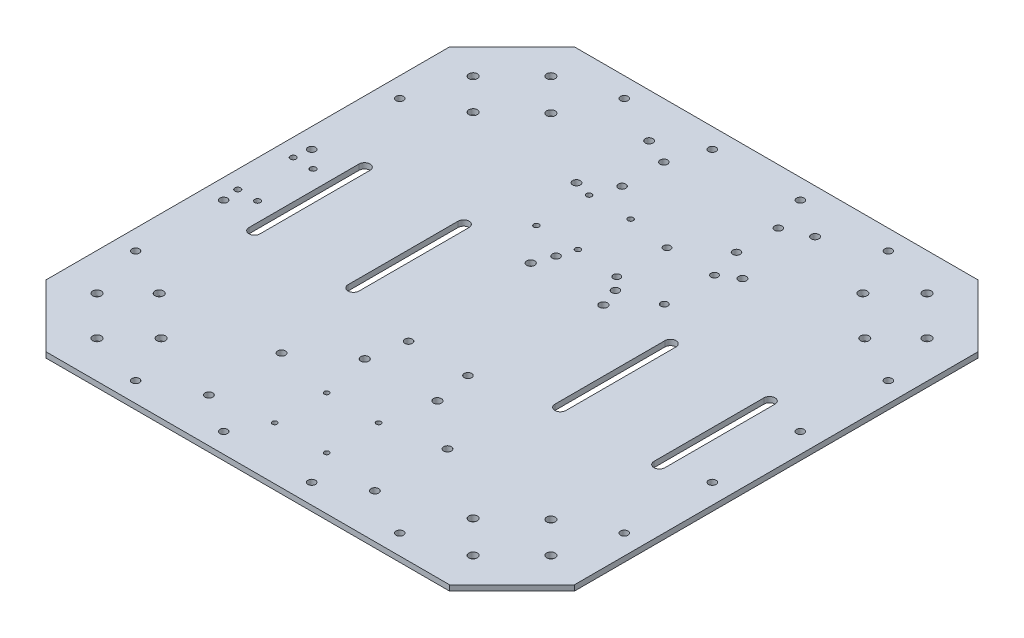
from build123d import *

# Parameters (mm, degrees)
BOSS_EXTRUDE1_DEPTH = 3.175
SKETCH2_R           = 2.4638
CUT_EXTRUDE1_DEPTH  = 6.35
SKETCH3_R           = 2.159
CUT_EXTRUDE2_DEPTH  = 6.35
SKETCH4_R           = 2.2225
SKETCH4_R_2         = 2.286
CUT_EXTRUDE3_DEPTH  = 351.937720963
SKETCH5_R           = 1.651
CUT_EXTRUDE4_DEPTH  = 351.937720963
SKETCH6_R           = 2.032
SKETCH6_R_2         = 2.159
SKETCH6_R_3         = 1.397
SKETCH6_R_4         = 1.5499969
CUT_EXTRUDE5_DEPTH  = 351.937720963
SKETCH7_R           = 2.159
CUT_EXTRUDE6_DEPTH  = 351.937720963
CUT_EXTRUDE8_DEPTH  = 351.937720963


with BuildPart() as part:
    # Sketch1 → Boss-Extrude1 (new body)
    with BuildSketch(Plane(origin=(0, 0, 0), x_dir=(1, 0, 0), z_dir=(0, 1, 0))):
        Polygon((-25.845025354, 51.656360067), (-61.766049839, 15.735335583), (-61.766049839, -217.222615449), (-25.845025354, -253.143639933), (207.112925677, -253.143639933), (243.033950161, -217.222615449), (243.033950161, 15.735335583), (207.112925677, 51.656360067), align=None)
    extrude(amount=BOSS_EXTRUDE1_DEPTH)

    # Sketch2 → Cut-Extrude1 (cut)
    with BuildSketch(Plane(origin=(0, 3.175, 0), x_dir=(1, 0, 0), z_dir=(0, 1, 0))):
        with Locations(Location((-17.872380726, 30.213331256, 0), (0, 0, 270))):
            Circle(SKETCH2_R)
        with Locations(Location((0.640891541, 11.70005899, 0), (0, 0, 270))):
            Circle(SKETCH2_R)
        with Locations(Location((-22.362508786, -10.197821288, 0), (0, 0, 270))):
            Circle(SKETCH2_R)
        with Locations(Location((-40.323021028, 7.762690954, 0), (0, 0, 270))):
            Circle(SKETCH2_R)
        with Locations(Location((203.630409109, -10.197821288, 0), (0, 0, 270))):
            Circle(SKETCH2_R)
        with Locations(Location((221.590921351, 7.762690954, 0), (0, 0, 270))):
            Circle(SKETCH2_R)
        with Locations(Location((180.627008782, 11.70005899, 0), (0, 0, 270))):
            Circle(SKETCH2_R)
        with Locations(Location((199.140281048, 30.213331256, 0), (0, 0, 270))):
            Circle(SKETCH2_R)
        with Locations(Location((-22.362508786, -191.289458578, 0), (0, 0, 270))):
            Circle(SKETCH2_R)
        with Locations(Location((-40.323021028, -209.24997082, 0), (0, 0, 270))):
            Circle(SKETCH2_R)
        with Locations(Location((-17.872380726, -231.700611123, 0), (0, 0, 270))):
            Circle(SKETCH2_R)
        with Locations(Location((0.640891541, -213.187338857, 0), (0, 0, 270))):
            Circle(SKETCH2_R)
        with Locations(Location((221.590921351, -209.24997082, 0), (0, 0, 270))):
            Circle(SKETCH2_R)
        with Locations(Location((199.140281048, -231.700611123, 0), (0, 0, 270))):
            Circle(SKETCH2_R)
        with Locations(Location((180.627008782, -213.187338857, 0), (0, 0, 270))):
            Circle(SKETCH2_R)
        with Locations(Location((203.630409109, -191.289458578, 0), (0, 0, 270))):
            Circle(SKETCH2_R)
    extrude(amount=-CUT_EXTRUDE1_DEPTH, mode=Mode.SUBTRACT)

    # Sketch3 → Cut-Extrude2 (cut)
    with BuildSketch(Plane(origin=(0, 3.175, 0), x_dir=(1, 0, 0), z_dir=(0, 1, 0))):
        with Locations(Location((73.488950161, -58.198639933, 0), (0, 0, 270))):
            Circle(SKETCH3_R)
        with Locations(Location((107.778950161, -58.198639933, 0), (0, 0, 270))):
            Circle(SKETCH3_R)
        with Locations(Location((73.488950161, -143.288639933, 0), (0, 0, 270))):
            Circle(SKETCH3_R)
        with Locations(Location((107.778950161, -143.288639933, 0), (0, 0, 270))):
            Circle(SKETCH3_R)
    extrude(amount=-CUT_EXTRUDE2_DEPTH, mode=Mode.SUBTRACT)

    # Sketch4 → Cut-Extrude3 (cut, through all)
    with BuildSketch(Plane(origin=(0, 3.175, 0), x_dir=(1, 0, 0), z_dir=(0, 1, 0))):
        with Locations(Location((42.754950161, 26.256360067, 0), (0, 0, 270))):
            Circle(SKETCH4_R)
        with Locations(Location((138.512950161, 26.256360067, 0), (0, 0, 270))):
            Circle(SKETCH4_R)
        with Locations(Location((42.754950161, -15.653639933, 0), (0, 0, 270))):
            Circle(SKETCH4_R)
        with Locations(Location((138.512950161, -15.653639933, 0), (0, 0, 270))):
            Circle(SKETCH4_R)
        with Locations(Location((138.512950161, -185.833639933, 0), (0, 0, 90))):
            Circle(SKETCH4_R)
        with Locations(Location((42.754950161, -185.833639933, 0), (0, 0, 90))):
            Circle(SKETCH4_R)
        with Locations(Location((138.512950161, -227.743639933, 0), (0, 0, 90))):
            Circle(SKETCH4_R)
        with Locations(Location((42.754950161, -227.743639933, 0), (0, 0, 90))):
            Circle(SKETCH4_R)
        with Locations(Location((69.678950161, -68.993639933, 0), (0, 0, 270))):
            Circle(SKETCH4_R_2)
        with Locations(Location((111.588950161, -68.993639933, 0), (0, 0, 270))):
            Circle(SKETCH4_R_2)
        with Locations(Location((69.678950161, -164.751639933, 0), (0, 0, 270))):
            Circle(SKETCH4_R_2)
        with Locations(Location((111.588950161, -164.751639933, 0), (0, 0, 270))):
            Circle(SKETCH4_R_2)
    extrude(amount=-CUT_EXTRUDE3_DEPTH, mode=Mode.SUBTRACT)

    # Sketch5 → Cut-Extrude4 (cut, through all)
    with BuildSketch(Plane(origin=(0, 3.175, 0), x_dir=(1, 0, 0), z_dir=(0, 1, 0))):
        with Locations(Location((-51.606049839, -84.741639933, 0), (0, 0, 270))):
            Circle(SKETCH5_R)
        with Locations(Location((-40.176049839, -84.741639933, 0), (0, 0, 270))):
            Circle(SKETCH5_R)
        with Locations(Location((-40.176049839, -116.745639933, 0), (0, 0, 90))):
            Circle(SKETCH5_R)
        with Locations(Location((-51.606049839, -116.745639933, 0), (0, 0, 90))):
            Circle(SKETCH5_R)
    extrude(amount=-CUT_EXTRUDE4_DEPTH, mode=Mode.SUBTRACT)

    # Sketch6 → Cut-Extrude5 (cut, through all)
    with BuildSketch(Plane(origin=(0, 3.175, 0), x_dir=(1, 0, 0), z_dir=(0, 1, 0))):
        with Locations(Location((101.301950161, -22.003639933, 0), (0, 0, 270))):
            Circle(SKETCH6_R)
        with Locations(Location((101.301950161, -50.959639933, 0), (0, 0, 270))):
            Circle(SKETCH6_R)
        with Locations(Location((128.733950161, -50.959639933, 0), (0, 0, 270))):
            Circle(SKETCH6_R)
        with Locations(Location((128.733950161, -22.003639933, 0), (0, 0, 270))):
            Circle(SKETCH6_R)
        with Locations(Location((57.613950161, 19.906360067, 0), (0, 0, 270))):
            Circle(SKETCH6_R_2)
        with Locations(Location((57.613950161, -4.223639933, 0), (0, 0, 270))):
            Circle(SKETCH6_R_2)
        with Locations(Location((123.653950161, -4.223639933, 0), (0, 0, 90))):
            Circle(SKETCH6_R_2)
        with Locations(Location((123.653950161, 19.906360067, 0), (0, 0, 90))):
            Circle(SKETCH6_R_2)
        with Locations(Location((75.647950161, -192.691639933, 0), (0, 0, 270))):
            Circle(SKETCH6_R_3)
        with Locations(Location((75.647950161, -222.663639933, 0), (0, 0, 270))):
            Circle(SKETCH6_R_3)
        with Locations(Location((105.619950161, -222.663639933, 0), (0, 0, 90))):
            Circle(SKETCH6_R_3)
        with Locations(Location((105.619950161, -192.691639933, 0), (0, 0, 90))):
            Circle(SKETCH6_R_3)
        with Locations(Location((52.533950161, -18.193639933, 0), (0, 0, 270))):
            Circle(SKETCH6_R_4)
        with Locations(Location((52.533950161, -48.593629933, 0), (0, 0, 270))):
            Circle(SKETCH6_R_4)
        with Locations(Location((76.533952961, -18.193639933, 0), (0, 0, 270))):
            Circle(SKETCH6_R_4)
        with Locations(Location((76.533952961, -48.593629933, 0), (0, 0, 270))):
            Circle(SKETCH6_R_4)
    extrude(amount=-CUT_EXTRUDE5_DEPTH, mode=Mode.SUBTRACT)

    # Sketch7 → Cut-Extrude6 (cut, through all)
    with BuildSketch(Plane(origin=(0, 3.175, 0), x_dir=(1, 0, 0), z_dir=(0, 1, 0))):
        with Locations(Location((65.233950161, 40.226360067, 0), (0, 0, 270))):
            Circle(SKETCH7_R)
        with Locations(Location((14.433950161, 40.226360067, 0), (0, 0, 270))):
            Circle(SKETCH7_R)
        with Locations(Location((-50.336049839, -75.343639933, 0), (0, 0, 270))):
            Circle(SKETCH7_R)
        with Locations(Location((-50.336049839, -24.543639933, 0), (0, 0, 270))):
            Circle(SKETCH7_R)
        with Locations(Location((231.603950161, -24.543639933, 0), (0, 0, 90))):
            Circle(SKETCH7_R)
        with Locations(Location((231.603950161, -75.343639933, 0), (0, 0, 90))):
            Circle(SKETCH7_R)
        with Locations(Location((166.833950161, 40.226360067, 0), (0, 0, 90))):
            Circle(SKETCH7_R)
        with Locations(Location((116.033950161, 40.226360067, 0), (0, 0, 90))):
            Circle(SKETCH7_R)
        with Locations(Location((116.033950161, -241.713639933, 0), (0, 0, 270))):
            Circle(SKETCH7_R)
        with Locations(Location((166.833950161, -241.713639933, 0), (0, 0, 270))):
            Circle(SKETCH7_R)
        with Locations(Location((231.603950161, -126.143639933, 0), (0, 0, 270))):
            Circle(SKETCH7_R)
        with Locations(Location((231.603950161, -176.943639933, 0), (0, 0, 270))):
            Circle(SKETCH7_R)
        with Locations(Location((-50.336049839, -176.943639933, 0), (0, 0, 90))):
            Circle(SKETCH7_R)
        with Locations(Location((-50.336049839, -126.143639933, 0), (0, 0, 90))):
            Circle(SKETCH7_R)
        with Locations(Location((14.433950161, -241.713639933, 0), (0, 0, 90))):
            Circle(SKETCH7_R)
        with Locations(Location((65.233950161, -241.713639933, 0), (0, 0, 90))):
            Circle(SKETCH7_R)
    extrude(amount=-CUT_EXTRUDE6_DEPTH, mode=Mode.SUBTRACT)

    # Sketch8 → Cut-Extrude8 (cut, through all)
    with BuildSketch(Plane(origin=(0, 3.175, 0), x_dir=(1, 0, 0), z_dir=(0, 1, 0))):
        with BuildLine():
            Line((-23.031049839, -68.993639933), (-23.031049839, -132.493639933))
            ThreePointArc((-23.031049839, -132.493639933), (-26.206049839, -135.668639933), (-29.381049839, -132.493639933))
            Line((-29.381049839, -132.493639933), (-29.381049839, -68.993639933))
            ThreePointArc((-29.381049839, -68.993639933), (-26.206049839, -65.818639933), (-23.031049839, -68.993639933))
        make_face()
        with BuildLine():
            Line((34.118950161, -68.993639933), (34.118950161, -132.493639933))
            ThreePointArc((34.118950161, -132.493639933), (30.943950161, -135.668639933), (27.768950161, -132.493639933))
            Line((27.768950161, -132.493639933), (27.768950161, -68.993639933))
            ThreePointArc((27.768950161, -68.993639933), (30.943950161, -65.818639933), (34.118950161, -68.993639933))
        make_face()
        with BuildLine():
            Line((204.298950161, -68.993639933), (204.298950161, -132.493639933))
            ThreePointArc((204.298950161, -132.493639933), (207.473950161, -135.668639933), (210.648950161, -132.493639933))
            Line((210.648950161, -132.493639933), (210.648950161, -68.993639933))
            ThreePointArc((210.648950161, -68.993639933), (207.473950161, -65.818639933), (204.298950161, -68.993639933))
        make_face()
        with BuildLine():
            Line((147.148950161, -68.993639933), (147.148950161, -132.493639933))
            ThreePointArc((147.148950161, -132.493639933), (150.323950161, -135.668639933), (153.498950161, -132.493639933))
            Line((153.498950161, -132.493639933), (153.498950161, -68.993639933))
            ThreePointArc((153.498950161, -68.993639933), (150.323950161, -65.818639933), (147.148950161, -68.993639933))
        make_face()
    extrude(amount=-CUT_EXTRUDE8_DEPTH, mode=Mode.SUBTRACT)


solid = part.part
